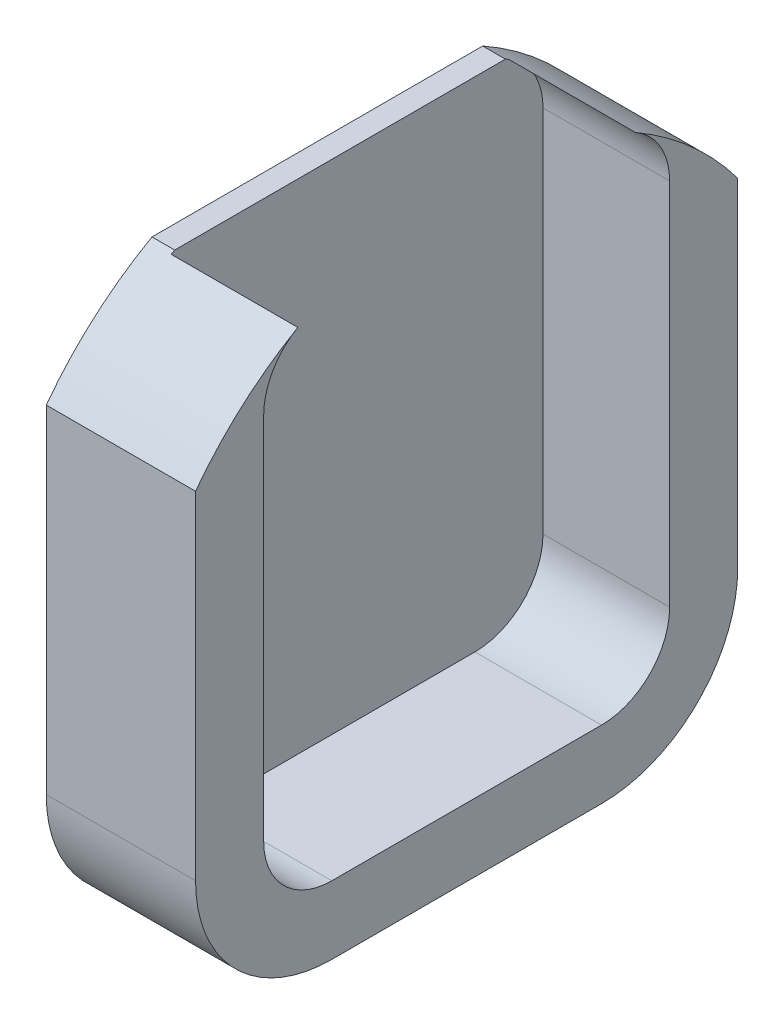
from build123d import *

# Parameters (mm, degrees)
BOSS_EXTRUDE1_START = -13.15
BOSS_EXTRUDE1_DEPTH = 2
BOSS_EXTRUDE2_START = -11.15
BOSS_EXTRUDE2_DEPTH = 11.15


with BuildPart() as part:
    # Sketch2 → Boss-Extrude1 (new body)
    with BuildSketch(Plane(origin=(0, 0, 0), x_dir=(0, 0, -1), z_dir=(1, 0, 0)).offset(BOSS_EXTRUDE1_START)):
        with BuildLine():
            Line((14.561593319, 6), (-14.561593319, 6))
            ThreePointArc((-14.561593319, 6), (-19.647313485, 2.405871392), (-23.875, -2.166762072))
            Line((-23.875, -2.166762072), (-23.875, -31.875))
            ThreePointArc((-23.875, -31.875), (-20.360281374, -40.360281374), (-11.875, -43.875))
            Line((-11.875, -43.875), (11.875, -43.875))
            ThreePointArc((11.875, -43.875), (20.360281374, -40.360281374), (23.875, -31.875))
            Line((23.875, -31.875), (23.875, -2.166762072))
            ThreePointArc((23.875, -2.166762072), (19.647313485, 2.405871392), (14.561593319, 6))
        make_face()
    extrude(amount=BOSS_EXTRUDE1_DEPTH)

    # Sketch2<3> → Boss-Extrude2 (add)
    with BuildSketch(Plane(origin=(0, 0, 0), x_dir=(0, 0, -1), z_dir=(1, 0, 0)).offset(BOSS_EXTRUDE2_START)):
        with BuildLine():
            ThreePointArc((17, 4.475293665), (15.948645849, 5.173015226), (14.868697479, 5.825604258))
            ThreePointArc((14.868697479, 5.825604258), (17.069332723, 3.628967773), (17.875, 0.625818166))
            Line((17.875, 0.625818166), (17.875, -31.875))
            ThreePointArc((17.875, -31.875), (16.117640687, -36.117640687), (11.875, -37.875))
            Line((11.875, -37.875), (-11.875, -37.875))
            ThreePointArc((-11.875, -37.875), (-16.117640687, -36.117640687), (-17.875, -31.875))
            Line((-17.875, -31.875), (-17.875, 0.625818166))
            ThreePointArc((-17.875, 0.625818166), (-17.069332723, 3.628967773), (-14.868697479, 5.825604258))
            ThreePointArc((-14.868697479, 5.825604258), (-15.948645849, 5.173015226), (-17, 4.475293665))
            ThreePointArc((-17, 4.475293665), (-20.70557008, 1.431737392), (-23.875, -2.166762072))
            Line((-23.875, -2.166762072), (-23.875, -31.875))
            ThreePointArc((-23.875, -31.875), (-20.360281374, -40.360281374), (-11.875, -43.875))
            Line((-11.875, -43.875), (11.875, -43.875))
            ThreePointArc((11.875, -43.875), (20.360281374, -40.360281374), (23.875, -31.875))
            Line((23.875, -31.875), (23.875, -2.166762072))
            ThreePointArc((23.875, -2.166762072), (20.70557008, 1.431737392), (17, 4.475293665))
        make_face()
    extrude(amount=BOSS_EXTRUDE2_DEPTH)


solid = part.part
